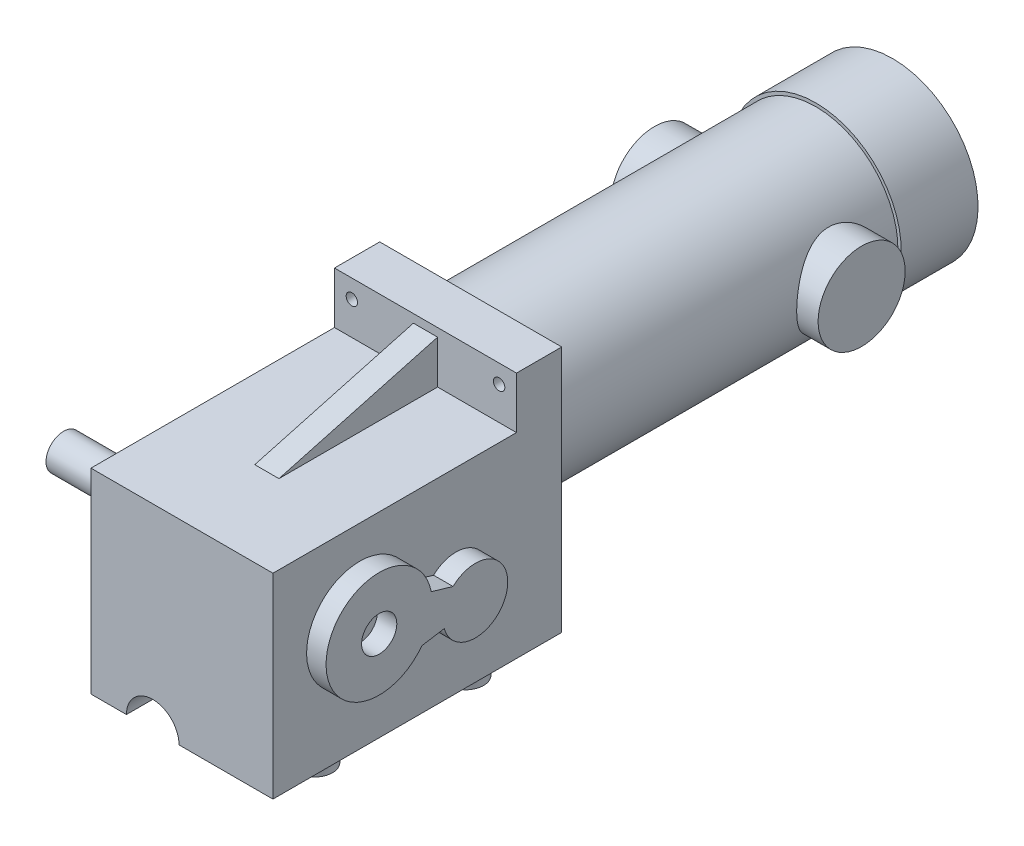
from build123d import *

# Parameters (mm, degrees)
SKETCH1_W                       = 87.884
SKETCH1_H                       = 94.488
BOSS_EXTRUDE1_DEPTH             = 139.446
SKETCH2_R                       = 8.5
BOSS_EXTRUDE2_DEPTH             = 55.118
SKETCH3_R                       = 39.6875
BOSS_EXTRUDE3_DEPTH             = 176.022
SKETCH4_W                       = 87.884
SKETCH4_H                       = 24.892
BOSS_EXTRUDE4_DEPTH             = 21.844
BOSS_EXTRUDE5_DEPTH             = 5.842
NOT_VERIFIED_EXTRUDE_DEPTH      = 10.033
SKETCH8_R                       = 2.75
CUT_EXTRUDE2_DEPTH              = 25.4
SKETCH7_R                       = 12.7
CHANGE_FOR_OPPOSITE_MOTOR_DEPTH = 339.432482365
SKETCH9_R                       = 3
CUT_EXTRUDE3_DEPTH              = 12.7
SKETCH10_R                      = 8.5725
BOSS_EXTRUDE6_DEPTH             = 6.096
SKETCH11_R                      = 1.5
CUT_EXTRUDE4_DEPTH              = 25.4
BOSS_EXTRUDE7_START             = 9.398
SKETCH12_R                      = 8.5
BOSS_EXTRUDE7_DEPTH             = 9.398
SKETCH13_R                      = 21.02690679
BOSS_EXTRUDE8_DEPTH             = 50.00625
SKETCH15_W                      = 14.986
SKETCH15_H                      = 14.986
BOSS_EXTRUDE9_DEPTH             = 6.35
BRAKE_AND_END_CAP_DEPTH         = 27.686
BRAKE_AND_END_CAP_DEPTH_BACK    = 9.398
SKETCH14_R                      = 41.275


with BuildPart() as part:
    # Sketch1 → Boss-Extrude1 (new body)
    with BuildSketch(Plane.XY):
        Rectangle(SKETCH1_W, SKETCH1_H)
    extrude(amount=-BOSS_EXTRUDE1_DEPTH)

    # Sketch2 → Boss-Extrude2 (add)
    with BuildSketch(Plane(origin=(-43.942, 0, 0), x_dir=(0, 0, -1), z_dir=(1, 0, 0))):
        with Locations(Location((41.91, 5.6388, 0), (0, 0, 90))):
            Circle(SKETCH2_R)
    extrude(amount=-BOSS_EXTRUDE2_DEPTH)

    # Sketch3 → Boss-Extrude3 (add)
    with BuildSketch(Plane(origin=(0, 0, -139.446), x_dir=(-1, 0, 0), z_dir=(0, 0, -1))):
        with Locations(Location((0, 27.686, 0), (0, 0, 150.475215814))):
            Circle(SKETCH3_R)
    extrude(amount=BOSS_EXTRUDE3_DEPTH)

    # Sketch4 → Boss-Extrude4 (add)
    with BuildSketch(Plane.XY.offset(-139.446)):
        with Locations((0, 59.69)):
            Rectangle(SKETCH4_W, SKETCH4_H)
    extrude(amount=BOSS_EXTRUDE4_DEPTH)

    # Sketch5 → Boss-Extrude5 (add, symmetric)
    with BuildSketch(Plane(origin=(0, 0, 0), x_dir=(0, 0, -1), z_dir=(1, 0, 0))):
        Polygon((41.00062989, 47.244), (117.602, 68.118364724), (117.602, 47.244), align=None)
    extrude(amount=BOSS_EXTRUDE5_DEPTH, both=True)

    # Sketch6 → not verified extrude (add)
    with BuildSketch(Plane(origin=(-43.942, 0, 0), x_dir=(0, 0, -1), z_dir=(1, 0, 0))):
        with BuildLine():
            Line((67.062792106, 10.685062506), (77.582823134, 7.605402716))
            ThreePointArc((77.582823134, 7.605402716), (103.428106849, -7.84112489), (73.318774576, -7.88601899))
            Line((73.318774576, -7.88601899), (62.51780348, -9.640144719))
            ThreePointArc((62.51780348, -9.640144719), (16.874294712, 11.237119098), (67.062792106, 10.685062506))
        make_face()
    extrude(amount=-NOT_VERIFIED_EXTRUDE_DEPTH)

    # Sketch8 → Cut-Extrude2 (cut)
    with BuildSketch(Plane(origin=(0, 0, -139.446), x_dir=(-1, 0, 0), z_dir=(0, 0, -1))):
        with Locations((-35.56, 63.246)):
            Circle(SKETCH8_R)
        with Locations((35.56, 63.246)):
            Circle(SKETCH8_R)
        with Locations((35.56, -7.874)):
            Circle(SKETCH8_R)
        with Locations((-35.56, -7.874)):
            Circle(SKETCH8_R)
    extrude(amount=-CUT_EXTRUDE2_DEPTH, mode=Mode.SUBTRACT)

    # Sketch7 → change for opposite motor (cut, through all)
    with BuildSketch(Plane.XY):
        with Locations((-14.097, -47.244)):
            Circle(SKETCH7_R)
    extrude(amount=-CHANGE_FOR_OPPOSITE_MOTOR_DEPTH, mode=Mode.SUBTRACT)

    # Sketch9 → Cut-Extrude3 (cut)
    with BuildSketch(Plane.XZ.offset(47.244)):
        with Locations((8.001, -7.9756)):
            Circle(SKETCH9_R)
        with Locations((8.001, -68.3768)):
            Circle(SKETCH9_R)
        with Locations((8.001, -128.778)):
            Circle(SKETCH9_R)
        with Locations((-36.449, -128.778)):
            Circle(SKETCH9_R)
        with Locations((-36.449, -68.3768)):
            Circle(SKETCH9_R)
        with Locations((-36.449, -7.9756)):
            Circle(SKETCH9_R)
    extrude(amount=-CUT_EXTRUDE3_DEPTH, mode=Mode.SUBTRACT)

    # Sketch10 → Boss-Extrude6 (add)
    with BuildSketch(Plane.XZ.offset(47.244)):
        with Locations(Location((32.639, -31.496, 0), (0, 0, 180))):
            Circle(SKETCH10_R)
        with Locations(Location((32.639, -104.4448, 0), (0, 0, 180))):
            Circle(SKETCH10_R)
    extrude(amount=BOSS_EXTRUDE6_DEPTH)

    # Sketch11 → Cut-Extrude4 (cut)
    with BuildSketch(Plane(origin=(0, 0, -315.468), x_dir=(-1, 0, 0), z_dir=(0, 0, -1))):
        with Locations(Location((-26.5, 27.686, 0), (0, 0, 90))):
            Circle(SKETCH11_R)
        with Locations(Location((26.5, 27.686, 0), (0, 0, 90))):
            Circle(SKETCH11_R)
    extrude(amount=-CUT_EXTRUDE4_DEPTH, mode=Mode.SUBTRACT)

    # Sketch12 → Boss-Extrude7 (add)
    with BuildSketch(Plane(origin=(43.942, 0, 0), x_dir=(0, 0, -1), z_dir=(1, 0, 0)).offset(BOSS_EXTRUDE7_START)):
        with BuildLine():
            Line((77.582823134, 7.605402716), (67.062792106, 10.685062506))
            ThreePointArc((67.062792106, 10.685062506), (16.874294712, 11.237119098), (62.51780348, -9.640144719))
            Line((62.51780348, -9.640144719), (73.318774576, -7.88601899))
            ThreePointArc((73.318774576, -7.88601899), (103.428106849, -7.84112489), (77.582823134, 7.605402716))
        make_face()
        with Locations(Location((41.91, 5.6388, 0), (0, 0, 90))):
            Circle(SKETCH12_R, mode=Mode.SUBTRACT)
    extrude(amount=-BOSS_EXTRUDE7_DEPTH)

    # Sketch13 → Boss-Extrude8 (add, symmetric)
    with BuildSketch(Plane(origin=(0, 0, 0), x_dir=(0, 0, -1), z_dir=(1, 0, 0))):
        with Locations(Location((278.212507153, 26.972524542, 0), (0, 0, 180))):
            Circle(SKETCH13_R)
    extrude(amount=BOSS_EXTRUDE8_DEPTH, both=True)

    # Sketch15 → Boss-Extrude9 (add)
    with BuildSketch(Plane(origin=(0, 0, -315.468), x_dir=(-1, 0, 0), z_dir=(0, 0, -1))):
        with Locations((0, 27.686)):
            Rectangle(SKETCH15_W, SKETCH15_H)
    extrude(amount=BOSS_EXTRUDE9_DEPTH)

    # Sketch14 → brake and end cap (add, two sides: drawn at the far end of the back side and taken through both)
    with BuildSketch(Plane(origin=(0, 0, -315.468), x_dir=(-1, 0, 0), z_dir=(0, 0, -1)).offset(-BRAKE_AND_END_CAP_DEPTH_BACK)):
        with Locations(Location((0, 27.686, 0), (0, 0, 90))):
            Circle(SKETCH14_R)
    extrude(amount=BRAKE_AND_END_CAP_DEPTH + BRAKE_AND_END_CAP_DEPTH_BACK)


solid = part.part
